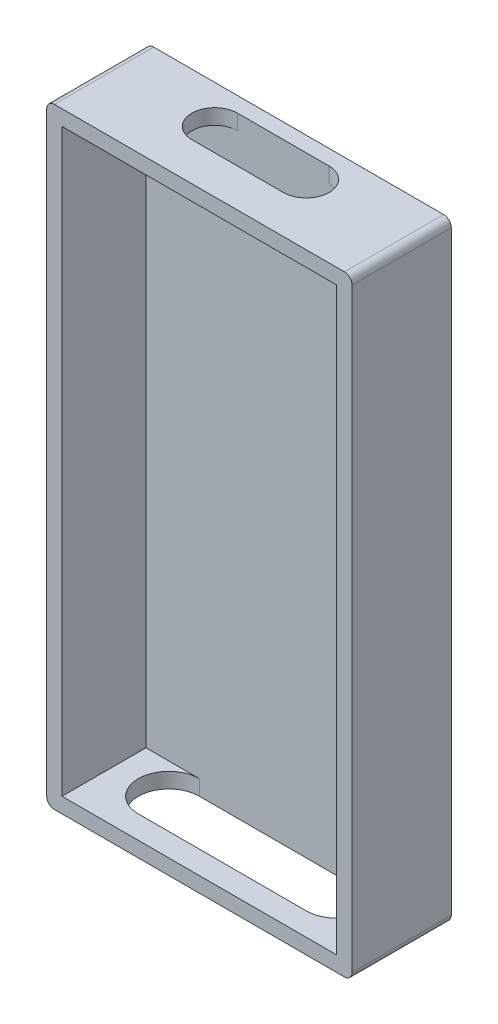
from build123d import *

# Parameters (mm, degrees)
SKETCH2_W           = 20
SKETCH2_H           = 40
BOSS_EXTRUDE1_DEPTH = 6.5
SKETCH4_W           = 17.997114687
SKETCH4_H           = 38
CUT_EXTRUDE1_DEPTH  = 5.5
CUT_EXTRUDE4_DEPTH  = 1
CUT_EXTRUDE5_DEPTH  = 1
FILLET1_R           = 0.5


with BuildPart() as part:
    # Sketch2 → Boss-Extrude1 (new body)
    with BuildSketch(Plane.XY):
        Rectangle(SKETCH2_W, SKETCH2_H)
    extrude(amount=BOSS_EXTRUDE1_DEPTH)

    # Sketch4 → Cut-Extrude1 (cut)
    with BuildSketch(Plane.XY.offset(6.5)):
        with Locations((-0.001442657, 0)):
            Rectangle(SKETCH4_W, SKETCH4_H)
    extrude(amount=-CUT_EXTRUDE1_DEPTH, mode=Mode.SUBTRACT)

    # Sketch6 → Cut-Extrude4 (cut)
    with BuildSketch(Plane.XZ.offset(20)):
        with BuildLine():
            Line((-5.5, 5), (5.5, 5))
            ThreePointArc((5.5, 5), (7.5, 3), (5.5, 1))
            Line((5.5, 1), (-5.5, 1))
            ThreePointArc((-5.5, 1), (-7.5, 3), (-5.5, 5))
        make_face()
    extrude(amount=-CUT_EXTRUDE4_DEPTH, mode=Mode.SUBTRACT)

    # Sketch8 → Cut-Extrude5 (cut)
    with BuildSketch(Plane(origin=(0, 20, 0), x_dir=(1, 0, 0), z_dir=(0, 1, 0))):
        with BuildLine():
            Line((-3, -1), (3, -1))
            ThreePointArc((3, -1), (4.5, -2.5), (3, -4))
            Line((3, -4), (-3, -4))
            ThreePointArc((-3, -4), (-4.5, -2.5), (-3, -1))
        make_face()
    extrude(amount=-CUT_EXTRUDE5_DEPTH, mode=Mode.SUBTRACT)

    # Fillet1
    fillet1_edges = [part.edges().sort_by_distance(p)[0] for p in [
        (10, -20, 3.25),
        (-10, -20, 3.25),
        (-10, 20, 3.25),
        (10, 20, 3.25),
    ]]
    fillet(fillet1_edges, radius=FILLET1_R)


solid = part.part
